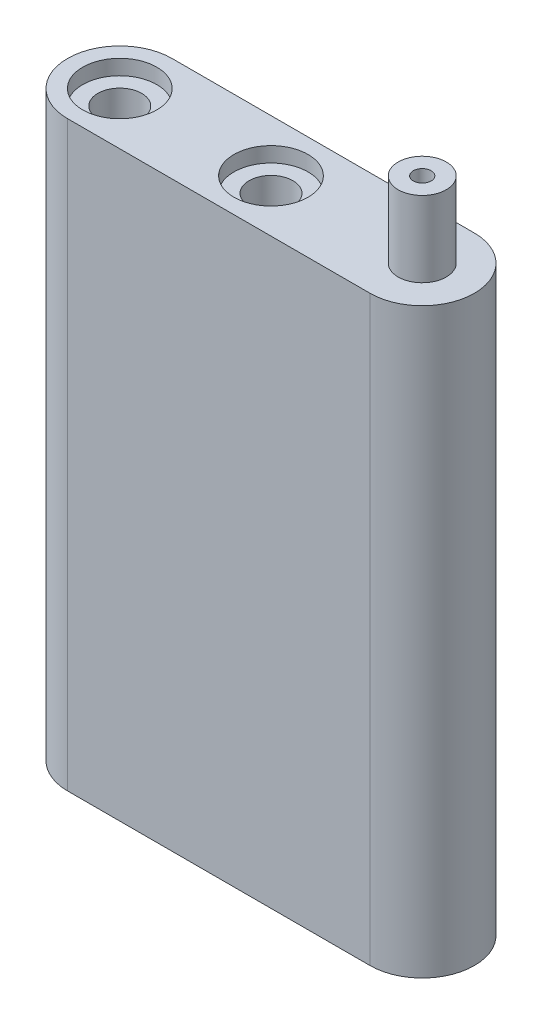
from build123d import *

# Parameters (mm, degrees)
CROQUIS2_R              = 1.45
SALIENTE_EXTRUIR1_DEPTH = 2.5
CROQUIS4_R              = 2.45
CORTAR_EXTRUIR1_DEPTH   = 1
CROQUIS5_R              = 1.59
CROQUIS5_R_2            = 0.59
SALIENTE_EXTRUIR2_DEPTH = 5
CROQUIS6_R              = 0.475
CORTAR_EXTRUIR2_DEPTH   = 25.224058289
SALIENTE_EXTRUIR3_START = 36
CROQUIS7_R              = 1.45
SALIENTE_EXTRUIR3_DEPTH = 36


with BuildPart() as part:
    # Croquis2 → Saliente-Extruir1 (new body)
    with BuildSketch(Plane(origin=(0, 0, 0), x_dir=(1, 0, 0), z_dir=(0, 1, 0))):
        with BuildLine():
            Line((0, 3.45), (20, 3.45))
            ThreePointArc((20, 3.45), (23.45, 0), (20, -3.45))
            Line((20, -3.45), (0, -3.45))
            ThreePointArc((0, -3.45), (-3.45, 0), (0, 3.45))
        make_face()
        with Locations(Location((0, 0, 0), (0, 0, 270))):
            Circle(CROQUIS2_R, mode=Mode.SUBTRACT)
        with Locations(Location((10, 0, 0), (0, 0, 270))):
            Circle(CROQUIS2_R, mode=Mode.SUBTRACT)
    extrude(amount=SALIENTE_EXTRUIR1_DEPTH)

    # Croquis4 → Cortar-Extruir1 (cut)
    with BuildSketch(Plane(origin=(0, 2.5, 0), x_dir=(1, 0, 0), z_dir=(0, 1, 0))):
        with Locations(Location((0, 0, 0), (0, 0, 270))):
            Circle(CROQUIS4_R)
        with Locations(Location((10, 0, 0), (0, 0, 270))):
            Circle(CROQUIS4_R)
    extrude(amount=-CORTAR_EXTRUIR1_DEPTH, mode=Mode.SUBTRACT)

    # Croquis5 → Saliente-Extruir2 (add)
    with BuildSketch(Plane(origin=(0, 2.5, 0), x_dir=(1, 0, 0), z_dir=(0, 1, 0))):
        with Locations(Location((20, 0, 0), (0, 0, 270))):
            Circle(CROQUIS5_R)
        with Locations(Location((20, 0, 0), (0, 0, 270))):
            Circle(CROQUIS5_R_2, mode=Mode.SUBTRACT)
    extrude(amount=SALIENTE_EXTRUIR2_DEPTH)

    # Croquis6 → Cortar-Extruir2 (cut, through all)
    with BuildSketch(Plane(origin=(0, 2.5, 0), x_dir=(1, 0, 0), z_dir=(0, 1, 0))):
        with Locations(Location((20, 0, 0), (0, 0, 270))):
            Circle(CROQUIS6_R)
    extrude(amount=-CORTAR_EXTRUIR2_DEPTH, mode=Mode.SUBTRACT)

    # Croquis7 → Saliente-Extruir3 (add)
    with BuildSketch(Plane.XZ.offset(SALIENTE_EXTRUIR3_START)):
        with BuildLine():
            Line((0, -3.45), (20, -3.45))
            ThreePointArc((20, -3.45), (23.45, 0), (20, 3.45))
            Line((20, 3.45), (0, 3.45))
            ThreePointArc((0, 3.45), (-3.45, 0), (0, -3.45))
        make_face()
        with Locations(Location((0, 0, 0), (0, 0, 270))):
            Circle(CROQUIS7_R, mode=Mode.SUBTRACT)
        with Locations(Location((10, 0, 0), (0, 0, 270))):
            Circle(CROQUIS7_R, mode=Mode.SUBTRACT)
    extrude(amount=-SALIENTE_EXTRUIR3_DEPTH)


solid = part.part
